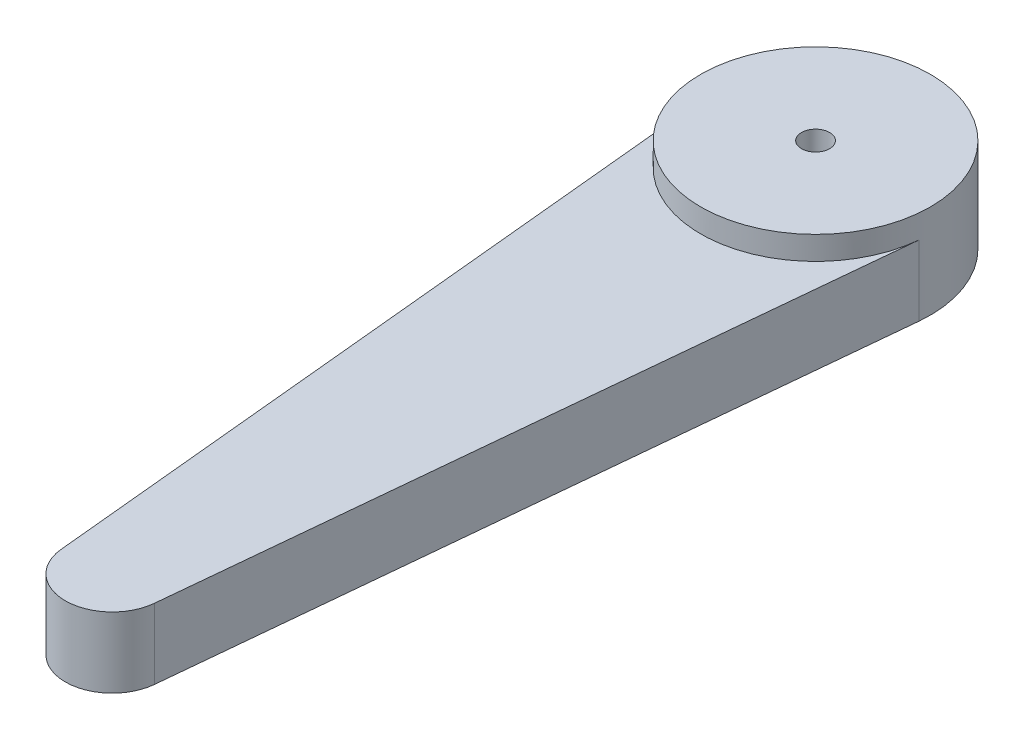
from build123d import *

# Parameters (mm, degrees)
CROQUIS1_R              = 24.5
CROQUIS1_R_2            = 3
SALIENTE_EXTRUIR1_DEPTH = 20
CROQUIS3_R              = 3
SALIENTE_EXTRUIR2_DEPTH = 15


with BuildPart() as part:
    # Croquis1 → Saliente-Extruir1 (new body)
    with BuildSketch(Plane(origin=(0, 0, 0), x_dir=(1, 0, 0), z_dir=(0, 1, 0))):
        with Locations(Location((0, 0, 0), (0, 0, 270))):
            Circle(CROQUIS1_R)
        with Locations(Location((0, 0, 0), (0, 0, 270))):
            Circle(CROQUIS1_R_2, mode=Mode.SUBTRACT)
    extrude(amount=SALIENTE_EXTRUIR1_DEPTH)

    # Croquis3 → Saliente-Extruir2 (add)
    with BuildSketch(Plane.XZ):
        with BuildLine():
            Line((-9.953168117, 150.966666667), (-24.385261863, 2.368333563))
            ThreePointArc((-24.385261863, 2.368333563), (1.09e-07, 24.5), (24.385261884, 2.368333346))
            Line((24.385261884, 2.368333346), (9.953168117, 150.966666667))
            ThreePointArc((9.953168117, 150.966666667), (0, 160), (-9.953168117, 150.966666667))
        make_face()
        Circle(CROQUIS3_R)
    extrude(amount=-SALIENTE_EXTRUIR2_DEPTH)


solid = part.part
